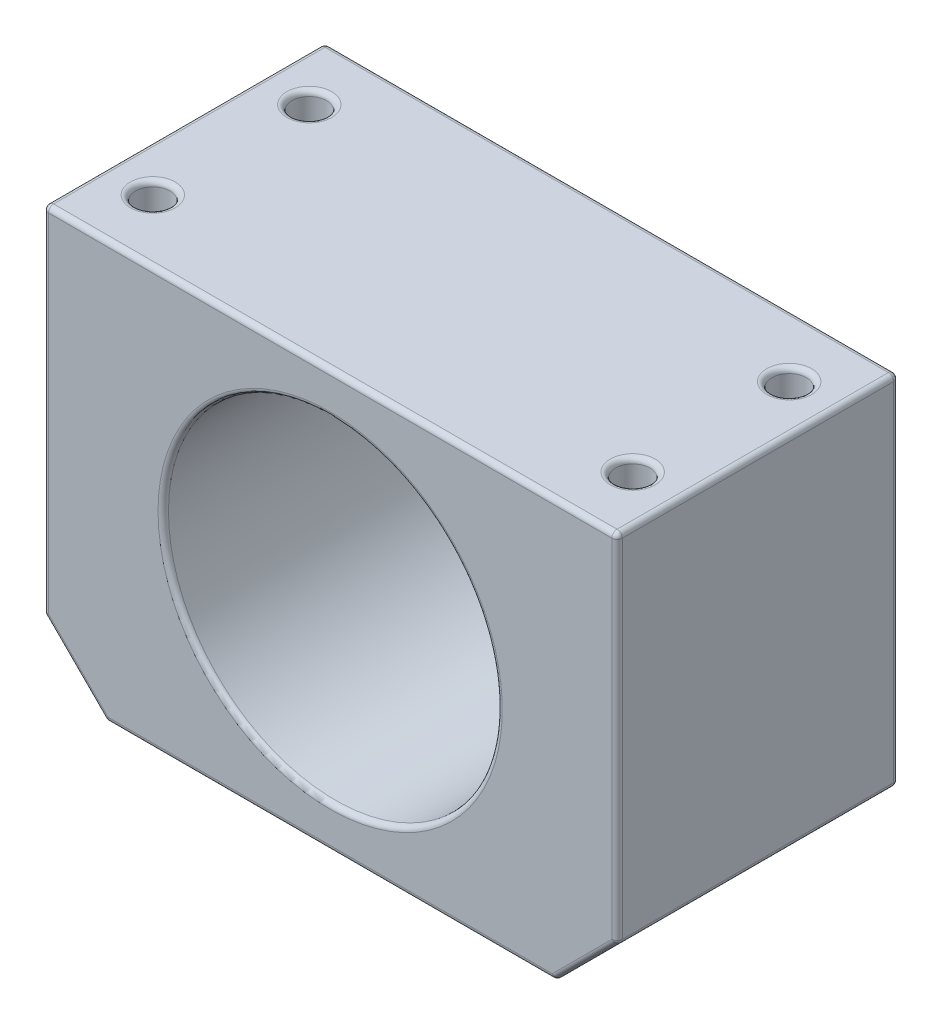
from build123d import *

# Parameters (mm, degrees)
SKETCH1_R             = 16
BOSS_EXTRUDE1_DEPTH   = 27
M4_TAPPED_HOLE1_D     = 3.3
M4_TAPPED_HOLE1_DEPTH = 10.1
M4_TAPPED_HOLE1_TIP   = 0.991420021
M4_TAPPED_HOLE2_D     = 3.3
M4_TAPPED_HOLE2_DEPTH = 10.1
M4_TAPPED_HOLE2_TIP   = 0.991420021
FILLET1_R             = 0.5


with BuildPart() as part:
    # Sketch1 → Boss-Extrude1 (new body)
    with BuildSketch(Plane.XY):
        Polygon((21.5, -20), (27.5, -14), (27.5, 20), (-27.5, 20), (-27.5, -14), (-21.5, -20), align=None)
        Circle(SKETCH1_R, mode=Mode.SUBTRACT)
    extrude(amount=BOSS_EXTRUDE1_DEPTH)

    # M4 Tapped Hole1
    with Locations(Plane(origin=(0, 0, 0), x_dir=(-1, 0, 0), z_dir=(0, 0, -1))):
        with Locations((18.186533479, 10.5), (18.186533479, -10.5), (-18.186533479, -10.5), (-18.186533479, 10.5)):
            Hole(M4_TAPPED_HOLE1_D / 2, depth=M4_TAPPED_HOLE1_DEPTH)
            with Locations((0, 0, -(M4_TAPPED_HOLE1_DEPTH + M4_TAPPED_HOLE1_TIP / 2))):  # 118° drill point
                Cone(0, M4_TAPPED_HOLE1_D / 2, M4_TAPPED_HOLE1_TIP, mode=Mode.SUBTRACT)

    # M4 Tapped Hole2
    with Locations(Plane(origin=(0, 20, 0), x_dir=(1, 0, 0), z_dir=(0, 1, 0))):
        with Locations((23, -21), (23, -6), (-23, -6), (-23, -21)):
            Hole(M4_TAPPED_HOLE2_D / 2, depth=M4_TAPPED_HOLE2_DEPTH)
            with Locations((0, 0, -(M4_TAPPED_HOLE2_DEPTH + M4_TAPPED_HOLE2_TIP / 2))):  # 118° drill point
                Cone(0, M4_TAPPED_HOLE2_D / 2, M4_TAPPED_HOLE2_TIP, mode=Mode.SUBTRACT)

    # Fillet1
    fillet1_edges = [part.edges().sort_by_distance(p)[0] for p in [
        (27.5, 3, 27),
        (-21.5, -20, 13.5),
        (-27.5, -14, 13.5),
        (-27.5, 20, 13.5),
        (27.5, 20, 13.5),
        (27.5, -14, 13.5),
        (21.5, -20, 13.5),
        (0, 20, 27),
        (-27.5, 3, 27),
        (-16, 0, 0),
        (-16, 0, 27),
        (-24.5, -17, 27),
        (16.536533479, 10.5, 0),
        (16.536533479, -10.5, 0),
        (-19.836533479, -10.5, 0),
        (-19.836533479, 10.5, 0),
        (0, -20, 27),
        (-21.35, 20, 21),
        (-21.35, 20, 6),
        (24.65, 20, 6),
        (24.65, 20, 21),
        (-24.5, -17, 0),
        (-27.5, 3, 0),
        (0, 20, 0),
        (24.5, -17, 27),
        (27.5, 3, 0),
        (24.5, -17, 0),
        (0, -20, 0),
    ]]
    fillet(fillet1_edges, radius=FILLET1_R)


solid = part.part
